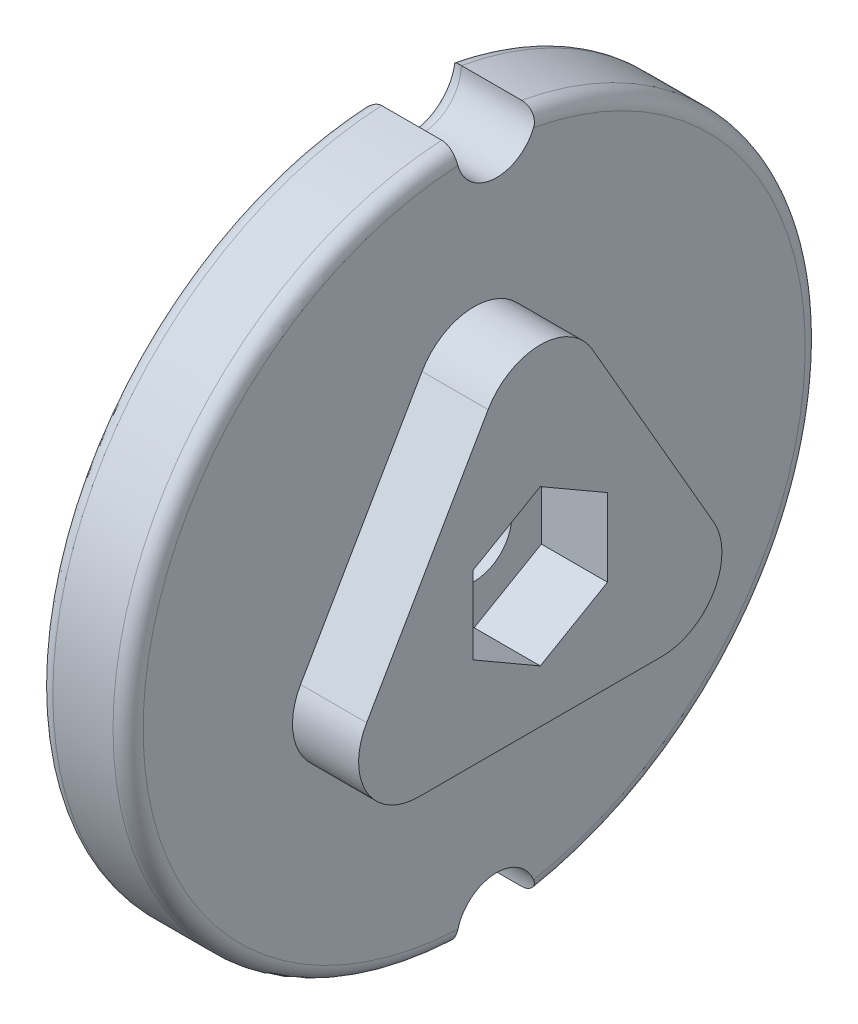
from build123d import *

# Parameters (mm, degrees)
SKETCH2_R           = 3.175
BOSS_EXTRUDE1_DEPTH = 7.62
BOSS_EXTRUDE2_DEPTH = 5.58
FILLET1_R           = 5.08
FILLET3_R           = 1.27


with BuildPart() as part:
    # Sketch2 → Boss-Extrude1 (new body)
    with BuildSketch(Plane(origin=(0, 0, 0), x_dir=(0, 0, -1), z_dir=(1, 0, 0))):
        with BuildLine():
            ThreePointArc((5.27282783, -28.730147697), (29.21, 0), (5.27282783, 28.730147697))
            ThreePointArc((5.27282783, 28.730147697), (1.672991049, 25.406627776), (-1.459953812, 29.17349199))
            ThreePointArc((-1.459953812, 29.17349199), (-29.21, 0), (-1.459953812, -29.17349199))
            ThreePointArc((-1.459953812, -29.17349199), (1.672991049, -25.406627776), (5.27282783, -28.730147697))
        make_face()
        with Locations(Location((0, 0, 0), (0, 0, 180))):
            Circle(SKETCH2_R, mode=Mode.SUBTRACT)
    extrude(amount=BOSS_EXTRUDE1_DEPTH)

    # Sketch3 → Boss-Extrude2 (add)
    with BuildSketch(Plane(origin=(7.62, 0, 0), x_dir=(0, 0, -1), z_dir=(1, 0, 0))):
        Polygon((19.05, -10.998522628), (0, 21.997045256), (-19.05, -10.998522628), align=None)
        Polygon((-5.675, 3.276462778), (-5.675, -3.276462778), (0, -6.552925555), (5.675, -3.276462778), (5.675, 3.276462778), (0, 6.552925555), align=None, mode=Mode.SUBTRACT)
    extrude(amount=BOSS_EXTRUDE2_DEPTH)

    # Fillet1
    fillet1_edges = [part.edges().sort_by_distance(p)[0] for p in [
        (10.41, -10.998522628, 19.05),
        (10.41, -10.998522628, -19.05),
        (10.41, 21.997045256, 0),
    ]]
    fillet(fillet1_edges, radius=FILLET1_R)

    # Fillet3
    fillet3_edges = [part.edges().sort_by_distance(p)[0] for p in [
        (0, 0, -3.175),
        (7.62, 0, -29.21),
        (7.62, 0, 29.21),
        (0, 25.406627776, -1.672991049),
        (0, 0, -29.21),
        (0, -25.406627776, -1.672991049),
        (0, 0, 29.21),
    ]]
    fillet(fillet3_edges, radius=FILLET3_R)


solid = part.part
